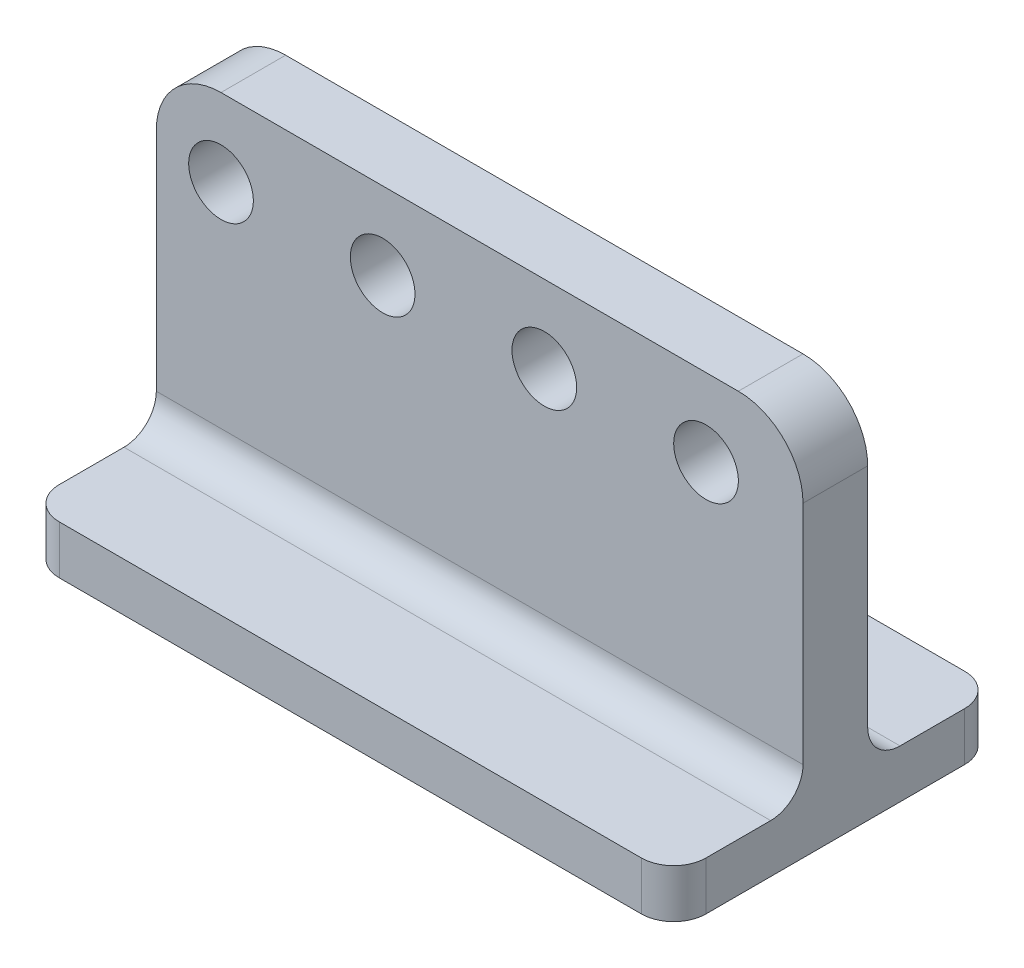
from build123d import *

# Parameters (mm, degrees)
SKETCH1_W           = 50.8
SKETCH1_H           = 25.4
BOSS_EXTRUDE1_DEPTH = 3.81
SKETCH2_W           = 50.8
SKETCH2_H           = 5.08
BOSS_EXTRUDE2_DEPTH = 25.4
CUT_EXTRUDE1_DEPTH  = 25.4
FILLET1_R           = 5.08
FILLET2_R           = 2.54
FILLET3_R           = 2.54


with BuildPart() as part:
    # Sketch1 → Boss-Extrude1 (new body)
    with BuildSketch(Plane(origin=(0, 0, 0), x_dir=(1, 0, 0), z_dir=(0, 1, 0))):
        with Locations((29.828717949, 2.800512821)):
            Rectangle(SKETCH1_W, SKETCH1_H)
    extrude(amount=BOSS_EXTRUDE1_DEPTH)

    # Sketch2 → Boss-Extrude2 (add)
    with BuildSketch(Plane(origin=(0, 3.81, 0), x_dir=(1, 0, 0), z_dir=(0, 1, 0))):
        with Locations((29.828717949, 2.800512821)):
            Rectangle(SKETCH2_W, SKETCH2_H)
    extrude(amount=BOSS_EXTRUDE2_DEPTH)

    # Sketch3 → Cut-Extrude1 (cut)
    with BuildSketch(Plane(origin=(0, 0, -5.340512821), x_dir=(-1, 0, 0), z_dir=(0, 0, -1))):
        with BuildLine():
            ThreePointArc((-6.968717949, 23.114), (-9.508717949, 25.654), (-12.048717949, 23.114))
            Line((-12.048717949, 23.114), (-6.968717949, 23.114))
        make_face()
        with BuildLine():
            Line((-6.968717949, 23.114), (-12.048717949, 23.114))
            ThreePointArc((-12.048717949, 23.114), (-9.508717949, 20.574), (-6.968717949, 23.114))
        make_face()
        with BuildLine():
            ThreePointArc((-19.668717949, 23.114), (-22.208717949, 25.654), (-24.748717949, 23.114))
            Line((-24.748717949, 23.114), (-19.668717949, 23.114))
        make_face()
        with BuildLine():
            Line((-19.668717949, 23.114), (-24.748717949, 23.114))
            ThreePointArc((-24.748717949, 23.114), (-22.208717949, 20.574), (-19.668717949, 23.114))
        make_face()
        with BuildLine():
            ThreePointArc((-37.448717949, 23.114), (-34.908717949, 20.574), (-32.368717949, 23.114))
            Line((-32.368717949, 23.114), (-37.448717949, 23.114))
        make_face()
        with BuildLine():
            Line((-37.448717949, 23.114), (-32.368717949, 23.114))
            ThreePointArc((-32.368717949, 23.114), (-34.908717949, 25.654), (-37.448717949, 23.114))
        make_face()
        with BuildLine():
            ThreePointArc((-50.148717949, 23.114), (-47.608717949, 20.574), (-45.068717949, 23.114))
            Line((-45.068717949, 23.114), (-50.148717949, 23.114))
        make_face()
        with BuildLine():
            Line((-50.148717949, 23.114), (-45.068717949, 23.114))
            ThreePointArc((-45.068717949, 23.114), (-47.608717949, 25.654), (-50.148717949, 23.114))
        make_face()
    extrude(amount=-CUT_EXTRUDE1_DEPTH, mode=Mode.SUBTRACT)

    # Fillet1
    fillet1_edges = [part.edges().sort_by_distance(p)[0] for p in [
        (4.428717949, 29.21, -2.800512821),
        (55.228717949, 29.21, -2.800512821),
    ]]
    fillet(fillet1_edges, radius=FILLET1_R)

    # Fillet2
    fillet2_edges = [part.edges().sort_by_distance(p)[0] for p in [
        (29.828717949, 3.81, -0.260512821),
        (29.828717949, 3.81, -5.340512821),
    ]]
    fillet(fillet2_edges, radius=FILLET2_R)

    # Fillet3
    fillet3_edges = [part.edges().sort_by_distance(p)[0] for p in [
        (4.428717949, 1.905, -15.500512821),
        (55.228717949, 1.905, -15.500512821),
        (55.228717949, 1.905, 9.899487179),
        (4.428717949, 1.905, 9.899487179),
    ]]
    fillet(fillet3_edges, radius=FILLET3_R)


solid = part.part
